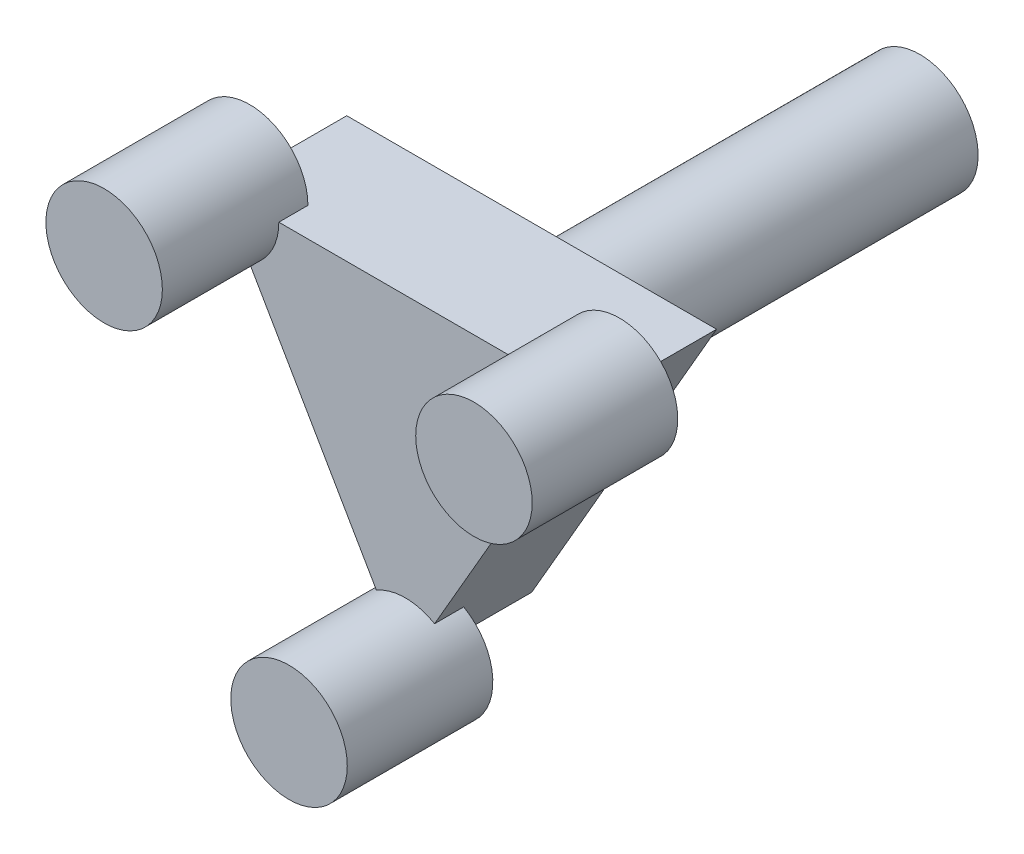
from build123d import *

# Parameters (mm, degrees)
SKETCH1_R             = 6
BOSS_EXTRUDE1_DEPTH   = 15
BOSS_EXTRUDE1_2_DEPTH = 15
BOSS_EXTRUDE1_3_DEPTH = 15
BOSS_EXTRUDE2_START   = -3
BOSS_EXTRUDE2_DEPTH   = 13
SKETCH4_R             = 6
BOSS_EXTRUDE3_DEPTH   = 40


with BuildPart() as part:
    # Sketch1 → Boss-Extrude1 (new body)
    with BuildSketch(Plane.XY):
        with Locations((0, -44)):
            Circle(SKETCH1_R)
    extrude(amount=BOSS_EXTRUDE1_DEPTH)



with BuildPart() as body_2:
    # Sketch1 → Boss-Extrude1 2 (new body)
    with BuildSketch(Plane.XY):
        with Locations((19.052558883, -11)):
            Circle(SKETCH1_R)
    extrude(amount=BOSS_EXTRUDE1_2_DEPTH)


with BuildPart() as body_3:
    # Sketch1 → Boss-Extrude1 3 (new body)
    with BuildSketch(Plane.XY):
        with Locations((-19.052558883, -11)):
            Circle(SKETCH1_R)
    extrude(amount=BOSS_EXTRUDE1_3_DEPTH)


with BuildPart() as part_1:
    add(part.part)

    add(body_2.part)  # Boss-Extrude2 merges body 2

    add(body_3.part)  # Boss-Extrude2 merges body 3
    # Sketch2 → Boss-Extrude2 (add)
    with BuildSketch(Plane(origin=(0, 0, 0), x_dir=(-1, 0, 0), z_dir=(0, 0, -1)).offset(BOSS_EXTRUDE2_START)):
        Polygon((-19.052558883, -11), (0, -44), (19.052558883, -11), align=None)
    extrude(amount=BOSS_EXTRUDE2_DEPTH)

    # Sketch4 → Boss-Extrude3 (add)
    with BuildSketch(Plane(origin=(0, 0, -10), x_dir=(-1, 0, 0), z_dir=(0, 0, -1))):
        with Locations((0, -22)):
            Circle(SKETCH4_R)
    extrude(amount=BOSS_EXTRUDE3_DEPTH)


solid = part_1.part
